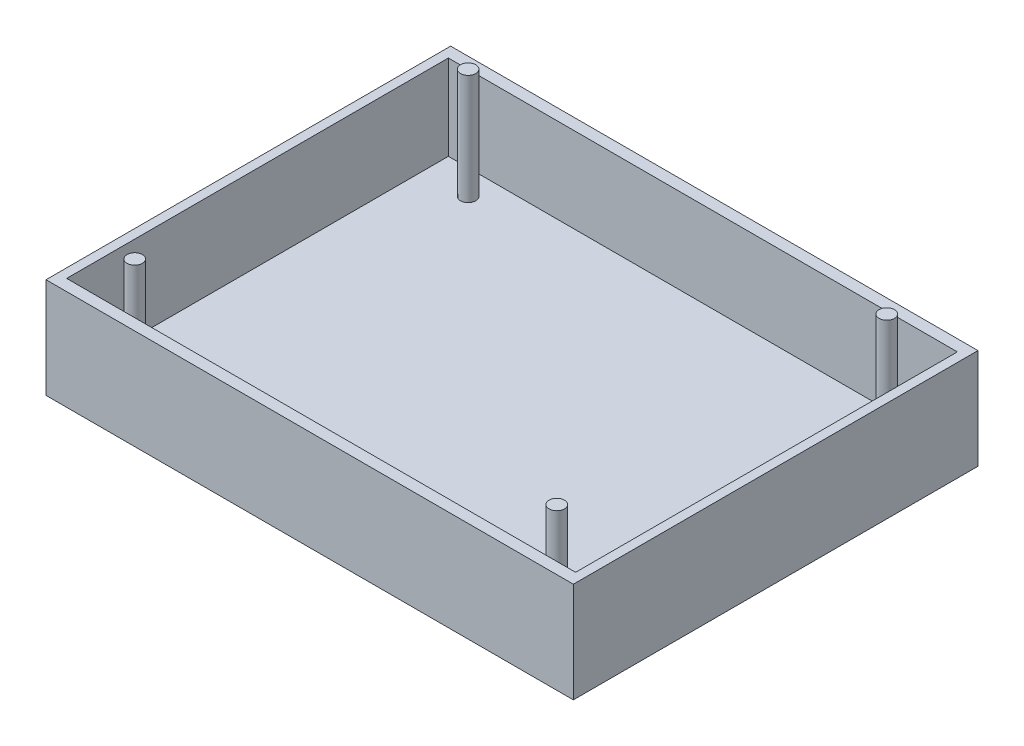
from build123d import *

# Parameters (mm, degrees)
SKETCH1_W           = 101.6
SKETCH1_H           = 76.2
SKETCH1_R           = 1.524
BOSS_EXTRUDE1_DEPTH = 3
SKETCH1_3_R         = 1.524
BOSS_EXTRUDE2_DEPTH = 25
SKETCH1_4_W         = 105.264465986
SKETCH1_4_H         = 80.768961322
SKETCH1_4_W_2       = 101.6
SKETCH1_4_H_2       = 76.2
BOSS_EXTRUDE3_DEPTH = 20


with BuildPart() as part:
    # Sketch1 → Boss-Extrude1 (new body)
    with BuildSketch(Plane(origin=(0, 0, 0), x_dir=(1, 0, 0), z_dir=(0, 1, 0))):
        Rectangle(SKETCH1_W, SKETCH1_H)
        with Locations((-42.370602661, -32.936523162)):
            Circle(SKETCH1_R, mode=Mode.SUBTRACT)
        with Locations((42.205092494, -33.267543495)):
            Circle(SKETCH1_R, mode=Mode.SUBTRACT)
        with Locations((-41.91, 33.147)):
            Circle(SKETCH1_R, mode=Mode.SUBTRACT)
        with Locations((42.205092494, 32.605502829)):
            Circle(SKETCH1_R, mode=Mode.SUBTRACT)
    extrude(amount=BOSS_EXTRUDE1_DEPTH)

    # Sketch1<3> → Boss-Extrude2 (add)
    with BuildSketch(Plane(origin=(0, 0, 0), x_dir=(1, 0, 0), z_dir=(0, 1, 0))):
        with Locations((-41.91, 33.147)):
            Circle(SKETCH1_3_R)
        with Locations((42.205092494, 32.605502829)):
            Circle(SKETCH1_3_R)
        with Locations((42.205092494, -33.267543495)):
            Circle(SKETCH1_3_R)
        with Locations((-42.370602661, -32.936523162)):
            Circle(SKETCH1_3_R)
    extrude(amount=BOSS_EXTRUDE2_DEPTH)

    # Sketch1<4> → Boss-Extrude3 (add)
    with BuildSketch(Plane(origin=(0, 0, 0), x_dir=(1, 0, 0), z_dir=(0, 1, 0))):
        Rectangle(SKETCH1_4_W, SKETCH1_4_H)
        Rectangle(SKETCH1_4_W_2, SKETCH1_4_H_2, mode=Mode.SUBTRACT)
    extrude(amount=BOSS_EXTRUDE3_DEPTH)


solid = part.part
